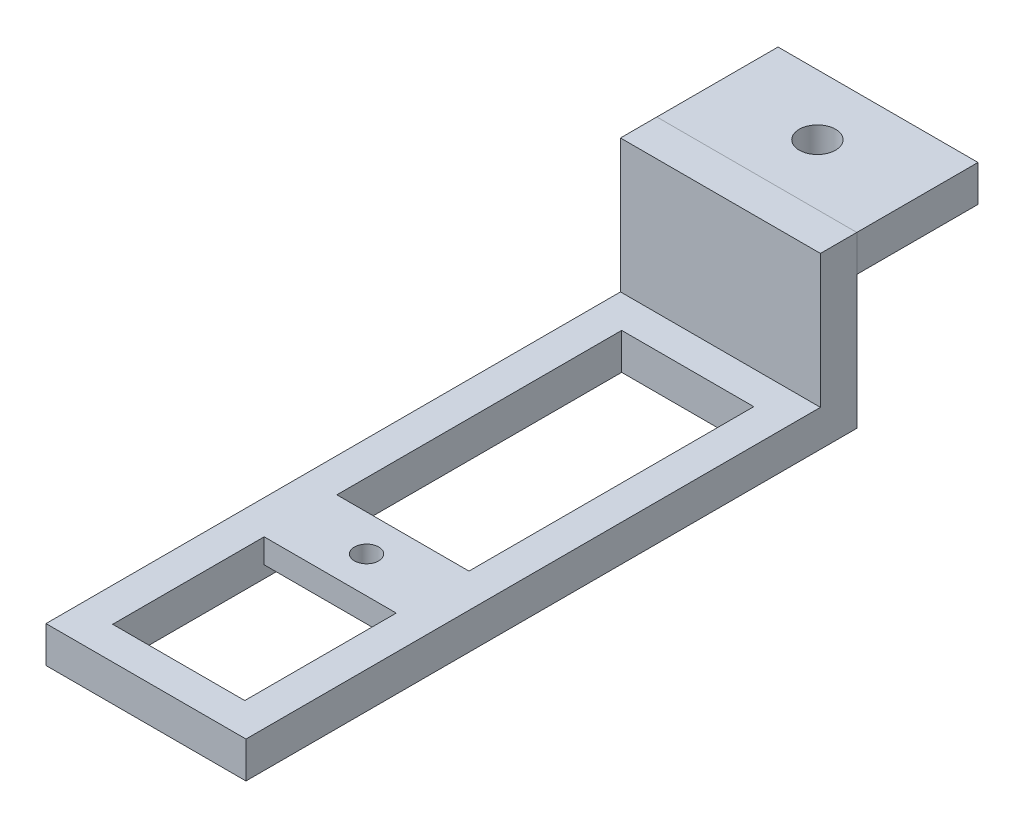
from build123d import *

# Parameters (mm, degrees)
SKETCH1_W               = 170
SKETCH1_H               = 3
BOSS_EXTRUDE1_DEPTH     = 10
SKETCH4_R               = 1.2
CUT_EXTRUDE1_DEPTH      = 21
SKETCH2_W               = 45.3
SKETCH2_H               = 3
BOSS_EXTRUDE6_DEPTH     = 20.3
SKETCH5_R               = 8.5
CUT_EXTRUDE2_DEPTH      = 20.3
SKETCH6_W               = 45.3
SKETCH6_H               = 3
BOSS_EXTRUDE7_DEPTH     = 20.3
SKETCH7_R               = 8.5
CUT_EXTRUDE3_DEPTH      = 100.885733504
SKETCH11_W              = 3
SKETCH11_H              = 14
BOSS_EXTRUDE10_DEPTH    = 16.5
SKETCH12_W              = 16.5
SKETCH12_H              = 3
BOSS_EXTRUDE11_DEPTH    = 47.4
SKETCH13_W              = 10.9
SKETCH13_H              = 42
CUT_EXTRUDE5_DEPTH      = 120.823102106
SKETCH14_W              = 23
SKETCH14_H              = 3
BOSS_EXTRUDE12_DEPTH    = 9.5
SKETCH15_W              = 17
SKETCH15_H              = 3.5
CUT_EXTRUDE6_DEPTH      = 9.5
CUT_EXTRUDE7_DEPTH      = 124.643656623
CUT_EXTRUDE7_DEPTH_BACK = 124.643656623
SKETCH16_W              = 63.359581381
SKETCH16_H              = 20.22579087
SKETCH16_W_2            = 63.3
SKETCH16_H_2            = 23.873064633
CUT_EXTRUDE9_DEPTH      = 85.468149706
CUT_EXTRUDE9_DEPTH_BACK = 85.468149706
SKETCH17_W              = 10.34603958
SKETCH17_H              = 19.965926612
SKETCH18_R              = 1.5
CUT_EXTRUDE10_DEPTH     = 10
SKETCH22_W              = 30.660472615
SKETCH22_H              = 85.471317495
CUT_EXTRUDE14_DEPTH     = 85.468149706
SKETCH23_W              = 30.27196453
SKETCH23_H              = 7.283480188
CUT_EXTRUDE15_DEPTH     = 74.568083116
SKETCH24_W              = 10.9
SKETCH24_H              = 6
SKETCH24_R              = 1
BOSS_EXTRUDE13_DEPTH    = 2


with BuildPart() as part:
    # Sketch1 → Boss-Extrude1 (new body)
    with BuildSketch(Plane.XY):
        with Locations((13.639372454, -9.657761352)):
            Rectangle(SKETCH1_W, SKETCH1_H)
    extrude(amount=BOSS_EXTRUDE1_DEPTH)

    # Sketch4 → Cut-Extrude1 (cut)
    with BuildSketch(Plane(origin=(0, -8.157761352, 0), x_dir=(1, 0, 0), z_dir=(0, 1, 0))):
        with Locations(Location((-63.360627546, -4.938536908, 0), (0, 0, 180))):
            Circle(SKETCH4_R)
        with Locations(Location((90.639372454, -5.283238547, 0), (0, 0, 180))):
            Circle(SKETCH4_R)
    extrude(amount=-CUT_EXTRUDE1_DEPTH, mode=Mode.SUBTRACT)

    # Sketch2 → Boss-Extrude6 (add)
    with BuildSketch(Plane(origin=(0, -8.157761352, 0), x_dir=(1, 0, 0), z_dir=(0, 1, 0))):
        with Locations((-30.710627546, -8.5)):
            Rectangle(SKETCH2_W, SKETCH2_H)
    extrude(amount=BOSS_EXTRUDE6_DEPTH)

    # Sketch5 → Cut-Extrude2 (cut)
    with BuildSketch(Plane(origin=(0, 0, 7), x_dir=(-1, 0, 0), z_dir=(0, 0, -1))):
        with Locations((17.460627546, 1.942238648)):
            Circle(SKETCH5_R)
        with Locations((43.960627546, 1.942238648)):
            Circle(SKETCH5_R)
        with BuildLine():
            Line((27.510627546, -3.557761352), (33.910627546, -3.557761352))
            ThreePointArc((33.910627546, -3.557761352), (35.810627546, -5.457761352), (33.910627546, -7.357761352))
            Line((33.910627546, -7.357761352), (27.510627546, -7.357761352))
            ThreePointArc((27.510627546, -7.357761352), (25.610627546, -5.457761352), (27.510627546, -3.557761352))
        make_face()
    extrude(amount=-CUT_EXTRUDE2_DEPTH, mode=Mode.SUBTRACT)

    # Sketch6 → Boss-Extrude7 (add)
    with BuildSketch(Plane(origin=(0, -8.157761352, 0), x_dir=(1, 0, 0), z_dir=(0, 1, 0))):
        with Locations((57.989372454, -8.5)):
            Rectangle(SKETCH6_W, SKETCH6_H)
    extrude(amount=BOSS_EXTRUDE7_DEPTH)

    # Sketch7 → Cut-Extrude3 (cut, through all)
    with BuildSketch(Plane.XY.offset(10)):
        with Locations((44.739372454, 1.942238648)):
            Circle(SKETCH7_R)
        with Locations((71.239372454, 1.942238648)):
            Circle(SKETCH7_R)
        with BuildLine():
            Line((54.839372454, -3.557761352), (61.239372454, -3.557761352))
            ThreePointArc((61.239372454, -3.557761352), (63.139372454, -5.457761352), (61.239372454, -7.357761352))
            Line((61.239372454, -7.357761352), (54.839372454, -7.357761352))
            ThreePointArc((54.839372454, -7.357761352), (52.939372454, -5.457761352), (54.839372454, -3.557761352))
        make_face()
    extrude(amount=-CUT_EXTRUDE3_DEPTH, mode=Mode.SUBTRACT)


with BuildPart() as body_2:
    # Sketch11 → Boss-Extrude10 (new body)
    with BuildSketch(Plane(origin=(98.639372454, 0, 0), x_dir=(0, 0, -1), z_dir=(1, 0, 0))):
        with Locations((-11.5, -15.157761352)):
            Rectangle(SKETCH11_W, SKETCH11_H)
    extrude(amount=BOSS_EXTRUDE10_DEPTH)


with BuildPart() as body_2_1:
    # Body-Move/Copy1: moved
    add(body_2.part.moved(Location((-106.640418619, 0, 0))))

    # Sketch12 → Boss-Extrude11 (add)
    with BuildSketch(Plane.XY.offset(13)):
        with Locations((0.248953835, -20.657761352)):
            Rectangle(SKETCH12_W, SKETCH12_H)
    extrude(amount=BOSS_EXTRUDE11_DEPTH)

    # Sketch13 → Cut-Extrude5 (cut, through all)
    with BuildSketch(Plane(origin=(0, -19.157761352, 0), x_dir=(1, 0, 0), z_dir=(0, 1, 0))):
        with Locations((0.248953835, -36.7)):
            Rectangle(SKETCH13_W, SKETCH13_H)
    extrude(amount=-CUT_EXTRUDE5_DEPTH, mode=Mode.SUBTRACT)


with BuildPart() as body_3:
    # Body-Move/Copy3: copy of body 2
    add(body_2_1.part.moved(Location((26.84603958, 0, 0))))


with BuildPart() as body_4:
    # Sketch14 → Boss-Extrude12 (new body)
    with BuildSketch(Plane(origin=(0, -19.157761352, 0), x_dir=(1, 0, 0), z_dir=(0, 1, 0))):
        with Locations((-0.888899403, -70.178295355)):
            Rectangle(SKETCH14_W, SKETCH14_H)
    extrude(amount=-BOSS_EXTRUDE12_DEPTH)

    # Sketch15 → Cut-Extrude6 (cut)
    with BuildSketch(Plane.XY.offset(71.678295355)):
        with Locations((-0.888899403, -23.907761352)):
            Rectangle(SKETCH15_W, SKETCH15_H)
    extrude(amount=-CUT_EXTRUDE6_DEPTH, mode=Mode.SUBTRACT)


with BuildPart() as body_5:
    # Body-Move/Copy4: copy of body 4
    add(body_4.part.moved(Location((29.098347772, 0, 0))))


with BuildPart() as cut_extrude7_tool:
    # Sketch16 → Cut-Extrude7 (new, two sides: drawn at the far end of the back side and taken through both)
    with BuildSketch(Plane(origin=(0, -8.157761352, 0), x_dir=(1, 0, 0), z_dir=(0, 1, 0)).offset(-CUT_EXTRUDE7_DEPTH_BACK)):
        with Locations((-39.680836856, -5.049901743)):
            Rectangle(SKETCH16_W, SKETCH16_H)
        with Locations((66.989372454, -3.392050033)):
            Rectangle(SKETCH16_W_2, SKETCH16_H_2)
    extrude(amount=CUT_EXTRUDE7_DEPTH + CUT_EXTRUDE7_DEPTH_BACK)


with BuildPart() as part_1:
    add(part.part)

    # Cut-Extrude7: cut by cut_extrude7_tool
    add(cut_extrude7_tool.part, mode=Mode.SUBTRACT)

    # Sketch17 → Cut-Extrude9 (cut, two sides: drawn at the far end of the back side and taken through both)
    with BuildSketch(Plane(origin=(0, -8.157761352, 0), x_dir=(1, 0, 0), z_dir=(0, 1, 0)).offset(-CUT_EXTRUDE9_DEPTH_BACK)):
        with Locations((13.671973625, -0.017036694)):
            Rectangle(SKETCH17_W, SKETCH17_H)
    extrude(amount=CUT_EXTRUDE9_DEPTH + CUT_EXTRUDE9_DEPTH_BACK, mode=Mode.SUBTRACT)


with BuildPart() as body_3_1:
    add(body_3.part)

    # Cut-Extrude7: cut by cut_extrude7_tool
    add(cut_extrude7_tool.part, mode=Mode.SUBTRACT)


with BuildPart() as cut_extrude9_piece_1:
    # of the separate pieces the step leaves, piece 1, a body of its own (cut_extrude9_pieces)
    add(part_1.part.solids().sort_by_distance((8.498953835, -11.157761352, 0))[0])


with BuildPart() as cut_extrude9_piece_2:
    # of the separate pieces the step leaves, piece 2, a body of its own (cut_extrude9_pieces)
    add(part_1.part.solids().sort_by_distance((35.339372454, -11.157761352, 0))[0])


with BuildPart() as cut_extrude10_tool:
    # Sketch18 → Cut-Extrude10 (new body)
    with BuildSketch(Plane(origin=(0, -8.157761352, 0), x_dir=(1, 0, 0), z_dir=(0, 1, 0))):
        with Locations(Location((0.248953835, -5, 0), (0, 0, 180))):
            Circle(SKETCH18_R)
        with Locations(Location((27.094993415, -5, 0), (0, 0, 180))):
            Circle(SKETCH18_R)
    extrude(amount=-CUT_EXTRUDE10_DEPTH)


with BuildPart() as cut_extrude9_piece_1_1:
    add(cut_extrude9_piece_1.part)

    # Cut-Extrude10: cut by cut_extrude10_tool
    add(cut_extrude10_tool.part, mode=Mode.SUBTRACT)


with BuildPart() as cut_extrude9_piece_2_1:
    add(cut_extrude9_piece_2.part)

    # Cut-Extrude10: cut by cut_extrude10_tool
    add(cut_extrude10_tool.part, mode=Mode.SUBTRACT)


with BuildPart() as cut_extrude14_tool:
    # Sketch22 → Cut-Extrude14 (new, through all)
    with BuildSketch(Plane(origin=(0, -8.157761352, 0), x_dir=(1, 0, 0), z_dir=(0, 1, 0))):
        with Locations((30.670536688, -31.705614743)):
            Rectangle(SKETCH22_W, SKETCH22_H)
    extrude(amount=-CUT_EXTRUDE14_DEPTH)


with BuildPart() as body_3_2:
    add(body_3_1.part)

    # Cut-Extrude14: cut by cut_extrude14_tool
    add(cut_extrude14_tool.part, mode=Mode.SUBTRACT)


with BuildPart() as body_5_1:
    add(body_5.part)

    # Cut-Extrude14: cut by cut_extrude14_tool
    add(cut_extrude14_tool.part, mode=Mode.SUBTRACT)


with BuildPart() as cut_extrude9_piece_2_2:
    add(cut_extrude9_piece_2_1.part)

    # Cut-Extrude14: cut by cut_extrude14_tool
    add(cut_extrude14_tool.part, mode=Mode.SUBTRACT)


with BuildPart() as body_4_1:
    add(body_4.part)

    # Sketch23 → Cut-Extrude15 (cut, through all)
    with BuildSketch(Plane(origin=(0, -19.157761352, 0), x_dir=(1, 0, 0), z_dir=(0, 1, 0))):
        with Locations((-0.513403302, -70.531997743)):
            Rectangle(SKETCH23_W, SKETCH23_H)
    extrude(amount=-CUT_EXTRUDE15_DEPTH, mode=Mode.SUBTRACT)


with BuildPart() as body_2_2:
    add(body_2_1.part)

    # Sketch24 → Boss-Extrude13 (add)
    with BuildSketch(Plane(origin=(0, -19.157761352, 0), x_dir=(1, 0, 0), z_dir=(0, 1, 0))):
        with Locations((0.248953835, -42.2)):
            Rectangle(SKETCH24_W, SKETCH24_H)
        with Locations(Location((0.248953835, -42.2, 0), (0, 0, 270))):
            Circle(SKETCH24_R, mode=Mode.SUBTRACT)
    extrude(amount=-BOSS_EXTRUDE13_DEPTH)


solid = Compound([cut_extrude9_piece_1_1.part, body_2_2.part])
